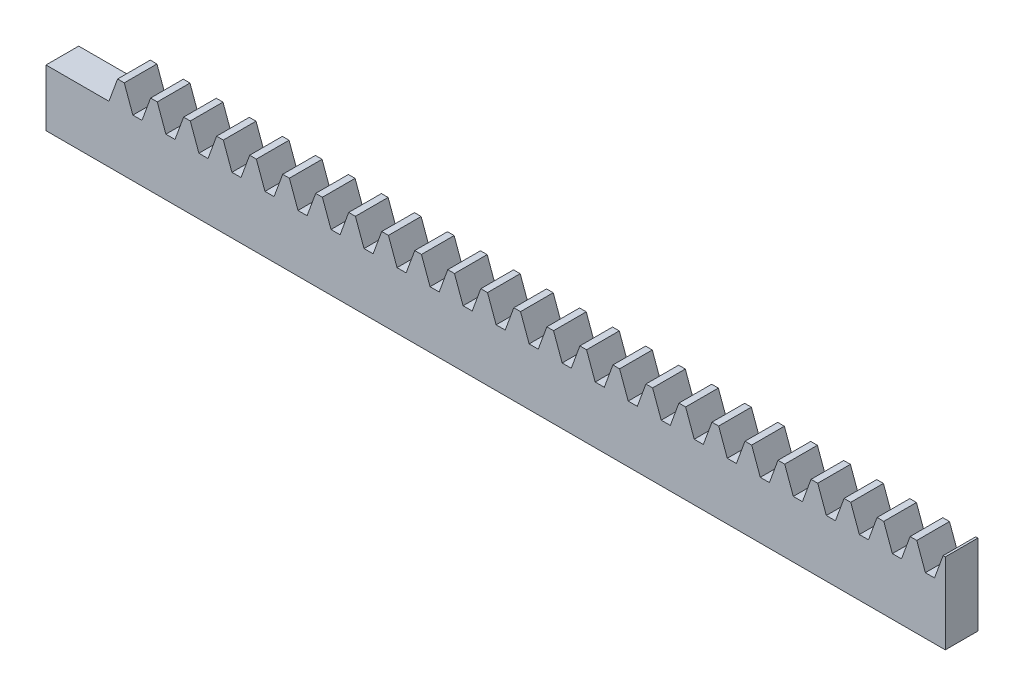
from build123d import *

# Parameters (mm, degrees)
BLANKSKE_W          = 180
BLANKSKE_H          = 17.25
BLANK_DEPTH         = 7
TOOTHCUTSIM_DEPTH   = 181.960113008
TEETHCUTS_COUNT     = 26
TEETHCUTS_PITCH     = 7.068583463
SKETCH1_W           = 7
SKETCH1_H           = 12.1875
BOSS_EXTRUDE1_DEPTH = 12.5


with BuildPart() as part:
    # BlankSke → Blank (new body)
    with BuildSketch(Plane.XY):
        with Locations((90, 8.625)):
            Rectangle(BLANKSKE_W, BLANKSKE_H)
    extrude(amount=-BLANK_DEPTH)

    # TooCutSkeSim → ToothCutSim (cut, through all)
    with BuildSketch(Plane.XY):
        Polygon((0.974479582, 12.1875), (-0.974479582, 12.1875), (-2.826323737, 17.2754), (2.826323737, 17.2754), align=None)
    toothcutsim = extrude(amount=-TOOTHCUTSIM_DEPTH, mode=Mode.SUBTRACT)

    # TeethCuts: ToothCutSim ×26
    with Locations(*[(i * TEETHCUTS_PITCH, 0, 0) for i in range(1, TEETHCUTS_COUNT)]):
        add(toothcutsim, mode=Mode.SUBTRACT)

    # Sketch1 → Boss-Extrude1 (add)
    with BuildSketch(Plane.ZY):
        with Locations((-3.5, 6.09375)):
            Rectangle(SKETCH1_W, SKETCH1_H)
    extrude(amount=BOSS_EXTRUDE1_DEPTH)


solid = part.part
